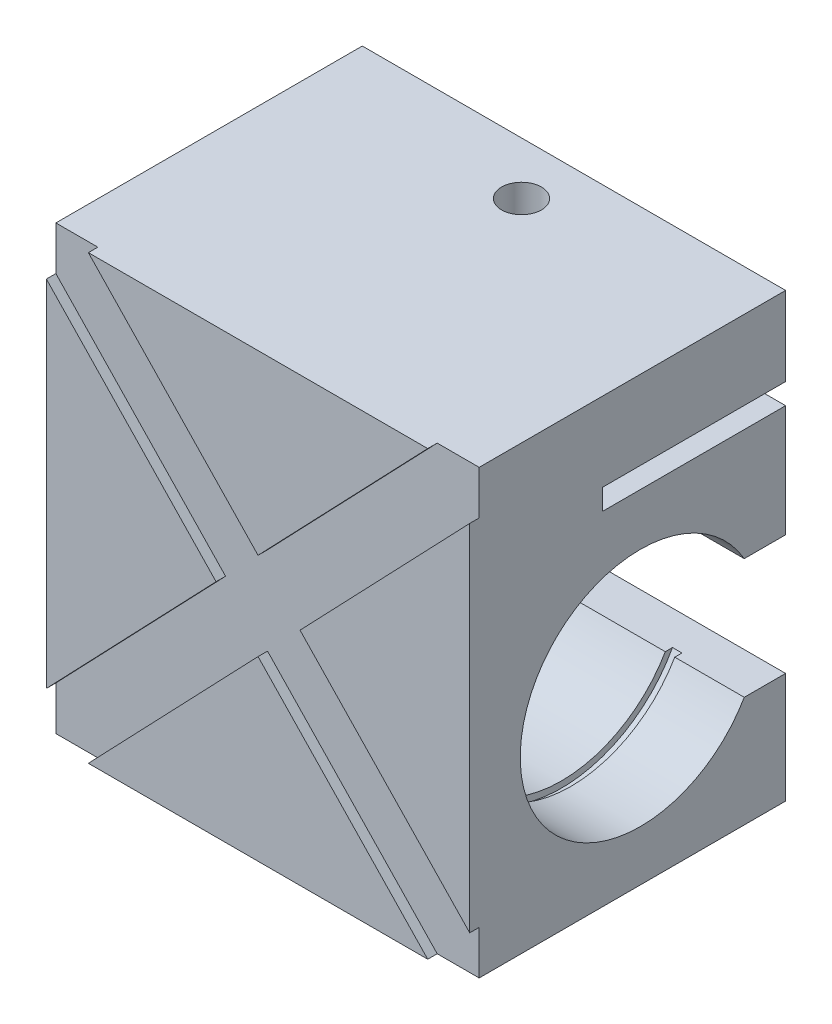
from build123d import *

# Parameters (mm, degrees)
ESQUISSE1_W             = 67
ESQUISSE1_H             = 50
BOSS_EXTRU_1_DEPTH      = 70
ESQUISSE2_W             = 29
ESQUISSE2_H             = 3.3
ENL_V_MAT_EXTRU_1_DEPTH = 101.069975517
ENL_V_START             = -12.5
ESQUISSE3_R             = 20
ENL_V_MAT_EXTRU_2_DEPTH = 1.5
ENL_V_MAT_EXTRU_3_REACH = 83.531
ESQUISSE5_R             = 3.15
ENL_V_MAT_EXTRU_4_DEPTH = 1.5


with BuildPart() as part:
    # Esquisse1 → Boss.-Extru.1 (new body)
    with BuildSketch(Plane(origin=(0, 0, 0), x_dir=(1, 0, 0), z_dir=(0, 1, 0))):
        Rectangle(ESQUISSE1_W, ESQUISSE1_H)
    extrude(amount=BOSS_EXTRU_1_DEPTH)

    # Esquisse2 → Enlèv. mat.-Extru.1 (cut, through all)
    with BuildSketch(Plane(origin=(33.5, 0, 0), x_dir=(0, 0, -1), z_dir=(1, 0, 0))):
        with Locations((10.5, 55.85)):
            Rectangle(ESQUISSE2_W, ESQUISSE2_H)
        with BuildLine():
            Line((25, 27), (25, 36.5))
            Line((25, 36.5), (18.454482672, 36.5))
            ThreePointArc((18.454482672, 36.5), (-17, 27), (18.454482672, 17.5))
            Line((18.454482672, 17.5), (25, 17.5))
            Line((25, 17.5), (25, 27))
        make_face()
    extrude(amount=-ENL_V_MAT_EXTRU_1_DEPTH, mode=Mode.SUBTRACT)

    # Esquisse3 → Enlèv. mat.-Extru.2 (cut)
    with BuildSketch(Plane(origin=(33.5, 0, 0), x_dir=(0, 0, -1), z_dir=(1, 0, 0)).offset(ENL_V_START)):
        with Locations((2, 27)):
            Circle(ESQUISSE3_R)
    enl_v_mat_extru_2 = extrude(amount=ENL_V_MAT_EXTRU_2_DEPTH, mode=Mode.SUBTRACT)

    # Symétrie1: Enlèv. mat.-Extru.2 across plane
    add(enl_v_mat_extru_2.mirror(Plane(origin=(0, 0, 0), x_dir=(0, 0, 1), z_dir=(1, 0, 0))), mode=Mode.SUBTRACT)

    # Esquisse5 → Enlèv. mat.-Extru.3 (cut, up to next)
    with BuildSketch(Plane(origin=(0, 70, 0), x_dir=(1, 0, 0), z_dir=(0, 1, 0)), mode=Mode.PRIVATE) as enl_v_mat_extru_3_sk1:
        with Locations(Location((0, 16.7, 0), (0, 0, 270))):
            Circle(ESQUISSE5_R)
    enl_v_mat_extru_3_tool1 = extrude(enl_v_mat_extru_3_sk1.sketch, amount=-ENL_V_MAT_EXTRU_3_REACH, mode=Mode.PRIVATE) & part.part
    add(enl_v_mat_extru_3_tool1.solids().sort_by_distance((0, 70, -16.7))[0], mode=Mode.SUBTRACT)

    # Esquisse6 → Enlèv. mat.-Extru.4 (cut)
    with BuildSketch(Plane.XY.offset(25)):
        Polygon((-30.032395101, -3.318993261), (0, 28.058135949), (30.032395101, -3.318993261), (36.967604899, 3.318993261), (6.644355591, 35), (36.967604899, 66.681006739), (30.032395101, 73.318993261), (0, 41.941864051), (-30.032395101, 73.318993261), (-36.967604899, 66.681006739), (-6.644355591, 35), (-36.967604899, 3.318993261), align=None)
    extrude(amount=-ENL_V_MAT_EXTRU_4_DEPTH, mode=Mode.SUBTRACT)


solid = part.part
